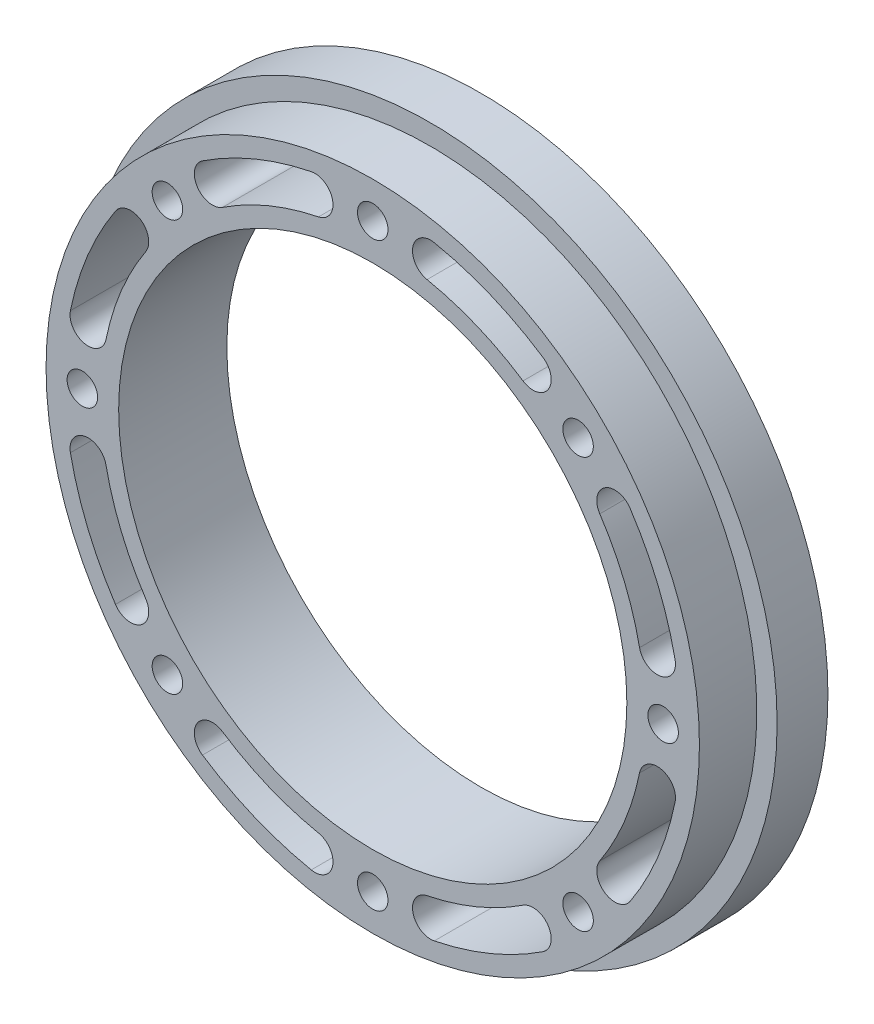
from build123d import *
from build123d.topology import SkipClean

# Parameters (mm, degrees)
SKETCH_1_R               = 45
SKETCH_1_R_2             = 1
SKETCH_1_R_3             = 35
EXTRUDE_2_DEPTH          = 14.9
EXTRUDE_START            = -4
SKETCH_3_R               = 47.8
SKETCH_3_R_2             = 45
EXTRUDE_3_DEPTH          = 4
PATTERN_CIRCULAR_1_COUNT = 8
CUT_EXTRUDE_2_DEPTH      = 12
SKETCH_14_R              = 47.8
SKETCH_14_R_2            = 45
CUT_EXTRUDE_3_DEPTH      = 10
SKETCH_15_R              = 47.8
SKETCH_15_R_2            = 45
EXTRUDE_4_DEPTH          = 7
CUT_EXTRUDE_4_DEPTH      = 10


with BuildPart() as part:
    # 草图1 → 凸台-拉伸2 (new body)
    with BuildSketch(Plane.XY):
        Circle(SKETCH_1_R)
        with Locations((0, 40)):
            Circle(SKETCH_1_R_2, mode=Mode.SUBTRACT)
        with Locations((28.284271247, 28.284271247)):
            Circle(SKETCH_1_R_2, mode=Mode.SUBTRACT)
        with Locations((40, 0)):
            Circle(SKETCH_1_R_2, mode=Mode.SUBTRACT)
        with Locations((28.284271247, -28.284271247)):
            Circle(SKETCH_1_R_2, mode=Mode.SUBTRACT)
        with Locations((0, -40)):
            Circle(SKETCH_1_R_2, mode=Mode.SUBTRACT)
        with Locations((-28.284271247, -28.284271247)):
            Circle(SKETCH_1_R_2, mode=Mode.SUBTRACT)
        Circle(SKETCH_1_R_3, mode=Mode.SUBTRACT)
        with Locations((-40, 0)):
            Circle(SKETCH_1_R_2, mode=Mode.SUBTRACT)
        with Locations((-28.284271247, 28.284271247)):
            Circle(SKETCH_1_R_2, mode=Mode.SUBTRACT)
    extrude(amount=EXTRUDE_2_DEPTH)

    # 草图3 → 凸台-拉伸3 (add)
    with BuildSketch(Plane.XY.offset(14.9).offset(EXTRUDE_START)):
        Circle(SKETCH_3_R)
        Circle(SKETCH_3_R_2, mode=Mode.SUBTRACT)
    extrude(amount=EXTRUDE_3_DEPTH)

    # 草图12 → M5 螺纹孔1 (revolve, cut)
    with BuildSketch(Plane(origin=(0, 40, 0), x_dir=(0, 1, 0), z_dir=(1, 0, 0))):
        Polygon((0, 0), (0, 23.6618073), (2.1, 22.4), (2.1, 0), align=None)
    hole_wizard_m5_1 = revolve(axis=Axis((0, 40, -6.35), (0, 0, 1)), mode=Mode.SUBTRACT)

    # 阵列(圆周)1: M5 螺纹孔1 ×8 about axis
    pattern_circular_1_axis = Axis((0, 0, 0), (0, 0, 1))
    for i in range(1, PATTERN_CIRCULAR_1_COUNT):
        add(hole_wizard_m5_1.rotate(pattern_circular_1_axis, i * 360 / PATTERN_CIRCULAR_1_COUNT), mode=Mode.SUBTRACT)

    # 草图13 → 切除-拉伸2 (cut)
    with BuildSketch(Plane(origin=(0, 0, 0), x_dir=(-1, 0, 0), z_dir=(0, 0, -1))):
        with BuildLine():
            ThreePointArc((-8.473137213, 41.646799946), (-16.264045876, 39.264880132), (-23.457321876, 35.440147438))
            ThreePointArc((-23.457321876, 35.440147438), (-24.162193968, 31.975590419), (-20.697636949, 31.270718328))
            ThreePointArc((-20.697636949, 31.270718328), (-14.350628714, 34.645482469), (-7.476297541, 36.747176423))
            ThreePointArc((-7.476297541, 36.747176423), (-5.524905615, 39.695408021), (-8.473137213, 41.646799946))
        make_face()
        with BuildLine():
            ThreePointArc((23.457321876, 35.440147438), (16.264045876, 39.264880132), (8.473137213, 41.646799946))
            ThreePointArc((8.473137213, 41.646799946), (5.524905615, 39.695408021), (7.476297541, 36.747176423))
            ThreePointArc((7.476297541, 36.747176423), (14.350628714, 34.645482469), (20.697636949, 31.270718328))
            ThreePointArc((20.697636949, 31.270718328), (24.162193968, 31.975590419), (23.457321876, 35.440147438))
        make_face()
        with BuildLine():
            ThreePointArc((41.646799946, 8.473137213), (39.264880132, 16.264045876), (35.440147438, 23.457321876))
            ThreePointArc((35.440147438, 23.457321876), (31.975590419, 24.162193968), (31.270718328, 20.697636949))
            ThreePointArc((31.270718328, 20.697636949), (34.645482469, 14.350628714), (36.747176423, 7.476297541))
            ThreePointArc((36.747176423, 7.476297541), (39.695408021, 5.524905615), (41.646799946, 8.473137213))
        make_face()
        with BuildLine():
            ThreePointArc((35.440147438, -23.457321876), (39.264880132, -16.264045876), (41.646799946, -8.473137213))
            ThreePointArc((41.646799946, -8.473137213), (39.695408021, -5.524905615), (36.747176423, -7.476297541))
            ThreePointArc((36.747176423, -7.476297541), (34.645482469, -14.350628714), (31.270718328, -20.697636949))
            ThreePointArc((31.270718328, -20.697636949), (31.975590419, -24.162193968), (35.440147438, -23.457321876))
        make_face()
        with BuildLine():
            ThreePointArc((8.473137213, -41.646799946), (16.264045876, -39.264880132), (23.457321876, -35.440147438))
            ThreePointArc((23.457321876, -35.440147438), (24.162193968, -31.975590419), (20.697636949, -31.270718328))
            ThreePointArc((20.697636949, -31.270718328), (14.350628714, -34.645482469), (7.476297541, -36.747176423))
            ThreePointArc((7.476297541, -36.747176423), (5.524905615, -39.695408021), (8.473137213, -41.646799946))
        make_face()
        with BuildLine():
            ThreePointArc((-23.457321876, -35.440147438), (-16.264045876, -39.264880132), (-8.473137213, -41.646799946))
            ThreePointArc((-8.473137213, -41.646799946), (-5.524905615, -39.695408021), (-7.476297541, -36.747176423))
            ThreePointArc((-7.476297541, -36.747176423), (-14.350628714, -34.645482469), (-20.697636949, -31.270718328))
            ThreePointArc((-20.697636949, -31.270718328), (-24.162193968, -31.975590419), (-23.457321876, -35.440147438))
        make_face()
        with BuildLine():
            ThreePointArc((-41.646799946, -8.473137213), (-39.264880132, -16.264045876), (-35.440147438, -23.457321876))
            ThreePointArc((-35.440147438, -23.457321876), (-31.975590419, -24.162193968), (-31.270718328, -20.697636949))
            ThreePointArc((-31.270718328, -20.697636949), (-34.645482469, -14.350628714), (-36.747176423, -7.476297541))
            ThreePointArc((-36.747176423, -7.476297541), (-39.695408021, -5.524905615), (-41.646799946, -8.473137213))
        make_face()
        with BuildLine():
            ThreePointArc((-35.440147438, 23.457321876), (-39.264880132, 16.264045876), (-41.646799946, 8.473137213))
            ThreePointArc((-41.646799946, 8.473137213), (-39.695408021, 5.524905615), (-36.747176423, 7.476297541))
            ThreePointArc((-36.747176423, 7.476297541), (-34.645482469, 14.350628714), (-31.270718328, 20.697636949))
            ThreePointArc((-31.270718328, 20.697636949), (-31.975590419, 24.162193968), (-35.440147438, 23.457321876))
        make_face()
    extrude(amount=-CUT_EXTRUDE_2_DEPTH, mode=Mode.SUBTRACT)

    # 草图14 → 切除-拉伸3 (cut)
    with SkipClean():  # the faces are left unmerged after this step: merging them gives an invalid solid
        with BuildSketch(Plane(origin=(0, 0, 10.9), x_dir=(-1, 0, 0), z_dir=(0, 0, -1))):
            Circle(SKETCH_14_R)
            Circle(SKETCH_14_R_2, mode=Mode.SUBTRACT)
        extrude(amount=-CUT_EXTRUDE_3_DEPTH, mode=Mode.SUBTRACT)

    # 草图15 → 凸台-拉伸4 (add)
    with BuildSketch(Plane(origin=(0, 0, 0), x_dir=(-1, 0, 0), z_dir=(0, 0, -1))):
        Circle(SKETCH_15_R)
        Circle(SKETCH_15_R_2, mode=Mode.SUBTRACT)
    extrude(amount=-EXTRUDE_4_DEPTH)

    # 草图16 → 切除-拉伸4 (cut)
    with SkipClean():  # the faces are left unmerged after this step: merging them gives an invalid solid
        with BuildSketch(Plane(origin=(0, 0, 12), x_dir=(-1, 0, 0), z_dir=(0, 0, -1))):
            with BuildLine():
                ThreePointArc((-20.697636949, -31.270718328), (-24.162193968, -31.975590419), (-23.457321876, -35.440147438))
                ThreePointArc((-23.457321876, -35.440147438), (-16.264045876, -39.264880132), (-8.473137213, -41.646799946))
                ThreePointArc((-8.473137213, -41.646799946), (-5.524905615, -39.695408021), (-7.476297541, -36.747176423))
                ThreePointArc((-7.476297541, -36.747176423), (-14.350628714, -34.645482469), (-20.697636949, -31.270718328))
            make_face()
            with BuildLine():
                ThreePointArc((7.476297541, -36.747176423), (5.524905615, -39.695408021), (8.473137213, -41.646799946))
                ThreePointArc((8.473137213, -41.646799946), (16.264045876, -39.264880132), (23.457321876, -35.440147438))
                ThreePointArc((23.457321876, -35.440147438), (24.162193968, -31.975590419), (20.697636949, -31.270718328))
                ThreePointArc((20.697636949, -31.270718328), (14.350628714, -34.645482469), (7.476297541, -36.747176423))
            make_face()
            with BuildLine():
                ThreePointArc((31.270718328, -20.697636949), (31.975590419, -24.162193968), (35.440147438, -23.457321876))
                ThreePointArc((35.440147438, -23.457321876), (39.264880132, -16.264045876), (41.646799946, -8.473137213))
                ThreePointArc((41.646799946, -8.473137213), (39.695408021, -5.524905615), (36.747176423, -7.476297541))
                ThreePointArc((36.747176423, -7.476297541), (34.645482469, -14.350628714), (31.270718328, -20.697636949))
            make_face()
            with BuildLine():
                ThreePointArc((36.747176423, 7.476297541), (39.695408021, 5.524905615), (41.646799946, 8.473137213))
                ThreePointArc((41.646799946, 8.473137213), (39.264880132, 16.264045876), (35.440147438, 23.457321876))
                ThreePointArc((35.440147438, 23.457321876), (31.975590419, 24.162193968), (31.270718328, 20.697636949))
                ThreePointArc((31.270718328, 20.697636949), (34.645482469, 14.350628714), (36.747176423, 7.476297541))
            make_face()
            with BuildLine():
                ThreePointArc((20.697636949, 31.270718328), (24.162193968, 31.975590419), (23.457321876, 35.440147438))
                ThreePointArc((23.457321876, 35.440147438), (16.264045876, 39.264880132), (8.473137213, 41.646799946))
                ThreePointArc((8.473137213, 41.646799946), (5.524905615, 39.695408021), (7.476297541, 36.747176423))
                ThreePointArc((7.476297541, 36.747176423), (14.350628714, 34.645482469), (20.697636949, 31.270718328))
            make_face()
            with BuildLine():
                ThreePointArc((-7.476297541, 36.747176423), (-5.524905615, 39.695408021), (-8.473137213, 41.646799946))
                ThreePointArc((-8.473137213, 41.646799946), (-16.264045876, 39.264880132), (-23.457321876, 35.440147438))
                ThreePointArc((-23.457321876, 35.440147438), (-24.162193968, 31.975590419), (-20.697636949, 31.270718328))
                ThreePointArc((-20.697636949, 31.270718328), (-14.350628714, 34.645482469), (-7.476297541, 36.747176423))
            make_face()
            with BuildLine():
                ThreePointArc((-31.270718328, 20.697636949), (-31.975590419, 24.162193968), (-35.440147438, 23.457321876))
                ThreePointArc((-35.440147438, 23.457321876), (-39.264880132, 16.264045876), (-41.646799946, 8.473137213))
                ThreePointArc((-41.646799946, 8.473137213), (-39.695408021, 5.524905615), (-36.747176423, 7.476297541))
                ThreePointArc((-36.747176423, 7.476297541), (-34.645482469, 14.350628714), (-31.270718328, 20.697636949))
            make_face()
            with BuildLine():
                ThreePointArc((-36.747176423, -7.476297541), (-39.695408021, -5.524905615), (-41.646799946, -8.473137213))
                ThreePointArc((-41.646799946, -8.473137213), (-39.264880132, -16.264045876), (-35.440147438, -23.457321876))
                ThreePointArc((-35.440147438, -23.457321876), (-31.975590419, -24.162193968), (-31.270718328, -20.697636949))
                ThreePointArc((-31.270718328, -20.697636949), (-34.645482469, -14.350628714), (-36.747176423, -7.476297541))
            make_face()
        extrude(amount=-CUT_EXTRUDE_4_DEPTH, mode=Mode.SUBTRACT)


solid = part.part
